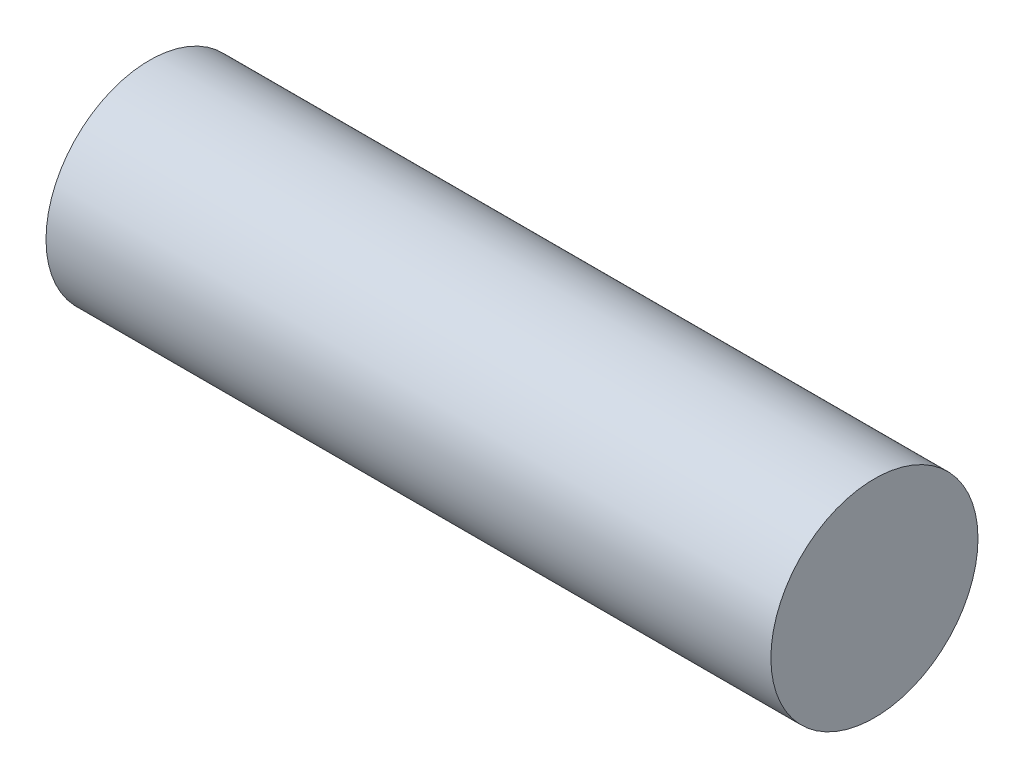
from build123d import *

# Parameters (mm, degrees)
SKETCH1_R           = 5
BOSS_EXTRUDE1_DEPTH = 17.5


with BuildPart() as part:
    # Sketch1 → Boss-Extrude1 (new, symmetric)
    with BuildSketch(Plane.YZ):
        with Locations(Location((0, 0, 0), (0, 0, 270))):
            Circle(SKETCH1_R)
    extrude(amount=BOSS_EXTRUDE1_DEPTH, both=True)


solid = part.part
